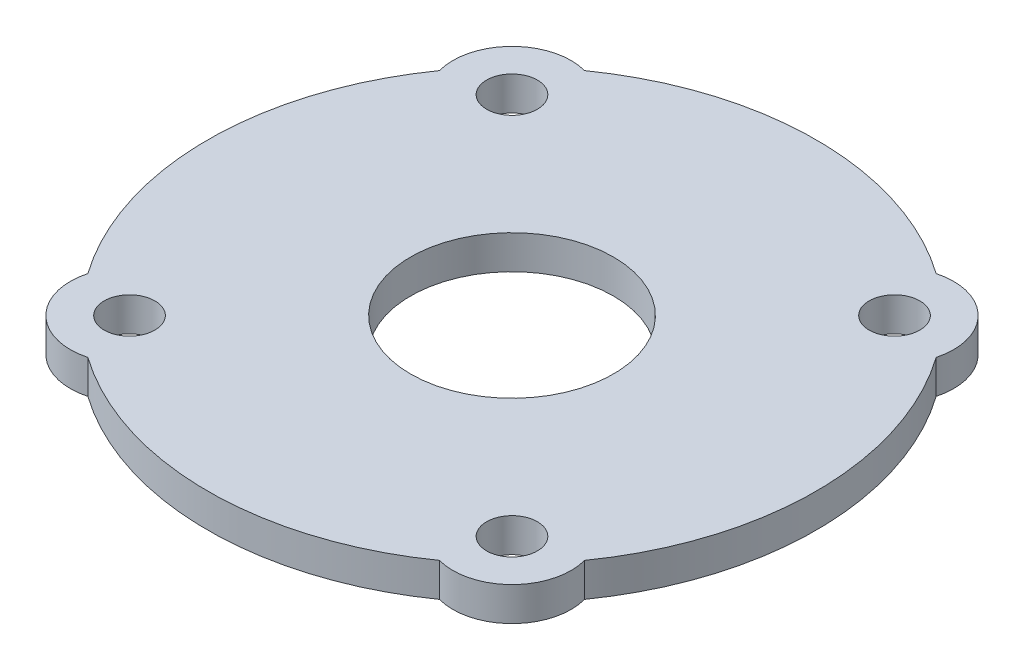
from build123d import *

# Parameters (mm, degrees)
SKETCH1_R           = 2.38125
SKETCH1_R_2         = 9.525
BOSS_EXTRUDE1_DEPTH = 1.5875


with BuildPart() as part:
    # Sketch1 → Boss-Extrude1 (new, symmetric)
    with BuildSketch(Plane(origin=(0, 0, 0), x_dir=(1, 0, 0), z_dir=(0, 1, 0))):
        with BuildLine():
            ThreePointArc((-16.508630953, 23.323716022), (-21.889374295, 21.889374295), (-23.323716022, 16.508630953))
            ThreePointArc((-23.323716022, 16.508630953), (-28.575, 0), (-23.323716022, -16.508630953))
            ThreePointArc((-23.323716022, -16.508630953), (-21.889374295, -21.889374295), (-16.508630953, -23.323716022))
            ThreePointArc((-16.508630953, -23.323716022), (0, -28.575), (16.508630953, -23.323716022))
            ThreePointArc((16.508630953, -23.323716022), (21.889374295, -21.889374295), (23.323716022, -16.508630953))
            ThreePointArc((23.323716022, -16.508630953), (28.575, 0), (23.323716022, 16.508630953))
            ThreePointArc((23.323716022, 16.508630953), (21.889374295, 21.889374295), (16.508630953, 23.323716022))
            ThreePointArc((16.508630953, 23.323716022), (0, 28.575), (-16.508630953, 23.323716022))
        make_face()
        with Locations(Location((-17.960512242, 17.960512242, 0), (0, 0, 270))):
            Circle(SKETCH1_R, mode=Mode.SUBTRACT)
        with Locations(Location((17.960512242, 17.960512242, 0), (0, 0, 90))):
            Circle(SKETCH1_R, mode=Mode.SUBTRACT)
        with Locations(Location((-17.960512242, -17.960512242, 0), (0, 0, 90))):
            Circle(SKETCH1_R, mode=Mode.SUBTRACT)
        with Locations(Location((17.960512242, -17.960512242, 0), (0, 0, 270))):
            Circle(SKETCH1_R, mode=Mode.SUBTRACT)
        with Locations(Location((0, 0, 0), (0, 0, 270))):
            Circle(SKETCH1_R_2, mode=Mode.SUBTRACT)
    extrude(amount=BOSS_EXTRUDE1_DEPTH, both=True)


solid = part.part
